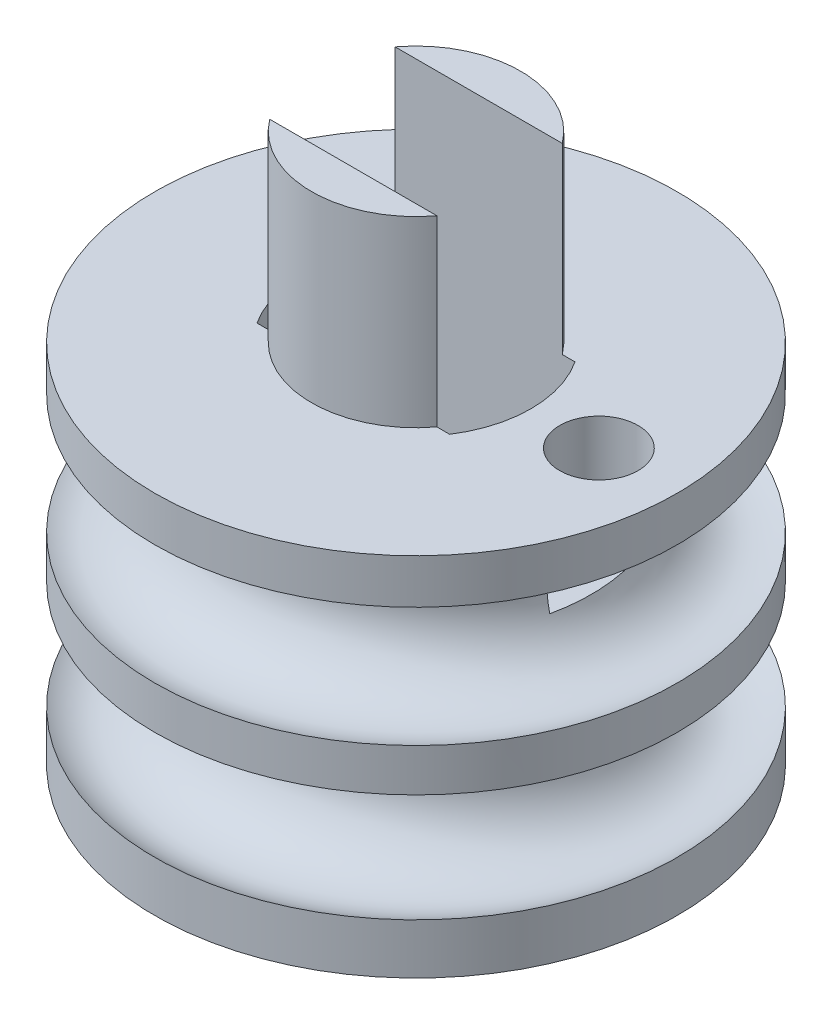
from build123d import *

# Parameters (mm, degrees)
SKETCH_1_R          = 2.75
EXTRUDE_1_DEPTH     = 8
CUT_EXTRUDE_1_DEPTH = 7
EXTRUDE_2_DEPTH     = 3.5
EXTRUDE_START       = -8
SKETCH_5_R          = 5
SKETCH_5_R_2        = 2.75
EXTRUDE_3_DEPTH     = 8
SWEEP_1_PROFILE_R   = 1.25
SWEEP_2_PROFILE_R   = 1.25
SKETCH_43_R         = 0.75
CUT_EXTRUDE_2_DEPTH = 2.5
SKETCH_47_R         = 5
SKETCH_47_R_2       = 2.5
CUT_EXTRUDE_3_DEPTH = 1
SKETCH_48_R         = 0.75
CUT_EXTRUDE_4_DEPTH = 2.5


with BuildPart() as part:
    # 草图1 → 凸台-拉伸1 (new body)
    with BuildSketch(Plane(origin=(0, 0, 0), x_dir=(1, 0, 0), z_dir=(0, 1, 0))):
        with Locations(Location((0, 0, 0), (0, 0, 270))):
            Circle(SKETCH_1_R)
    extrude(amount=EXTRUDE_1_DEPTH)

    # 草图2 → 切除-拉伸1 (cut)
    with BuildSketch(Plane(origin=(0, 8, 0), x_dir=(1, 0, 0), z_dir=(0, 1, 0))):
        with BuildLine():
            Line((1.843908891, 1.2), (-1.843908891, 1.2))
            ThreePointArc((-1.843908891, 1.2), (-2.2, 0), (-1.843908891, -1.2))
            Line((-1.843908891, -1.2), (1.843908891, -1.2))
            ThreePointArc((1.843908891, -1.2), (2.109099282, -0.625859584), (2.2, 0))
            ThreePointArc((2.2, 0), (2.109099282, 0.625859584), (1.843908891, 1.2))
        make_face()
    extrude(amount=-CUT_EXTRUDE_1_DEPTH, mode=Mode.SUBTRACT)

    # 草图4 → 凸台-拉伸2 (add)
    with BuildSketch(Plane(origin=(0, 8, 0), x_dir=(1, 0, 0), z_dir=(0, 1, 0))):
        with BuildLine():
            ThreePointArc((1.6, 1.2), (0, 2), (-1.6, 1.2))
            Line((-1.6, 1.2), (1.6, 1.2))
        make_face()
        with BuildLine():
            ThreePointArc((-1.6, -1.2), (0, -2), (1.6, -1.2))
            Line((1.6, -1.2), (-1.6, -1.2))
        make_face()
    extrude(amount=EXTRUDE_2_DEPTH)

    # 草图5 → 凸台-拉伸3 (add)
    with BuildSketch(Plane(origin=(0, 8, 0), x_dir=(1, 0, 0), z_dir=(0, 1, 0)).offset(EXTRUDE_START)):
        with Locations(Location((0, 0, 0), (0, 0, 270))):
            Circle(SKETCH_5_R)
        Circle(SKETCH_5_R_2, mode=Mode.SUBTRACT)
    extrude(amount=EXTRUDE_3_DEPTH)

    # 切除-扫描1: sweep along a path in 草图16
    with BuildLine(Plane(origin=(0, 3, 0), x_dir=(-1, 0, 0), z_dir=(0, -1, 0))) as sweep_1_path:
        CenterArc((0, 0), 4.3, 0, 360)
    # 切除-扫描1 profile (on start of the path) → 切除-扫描1 (sweep, cut)
    with BuildSketch(Plane(origin=(-4.3, 3, 0), x_dir=(-1, 0, 0), z_dir=(0, 0, -1))):
        Circle(SWEEP_1_PROFILE_R)
    sweep(path=sweep_1_path.line, mode=Mode.SUBTRACT)

    # 切除-扫描2: sweep along a path in 草图30
    with BuildLine(Plane(origin=(0, 6, 0), x_dir=(1, 0, 0), z_dir=(0, 1, 0))) as sweep_2_path:
        CenterArc((0, 0), 4.5, 0, 360)
    # 切除-扫描2 profile (on start of the path) → 切除-扫描2 (sweep, cut)
    with BuildSketch(Plane(origin=(4.5, 6, 0), x_dir=(-1, 0, 0), z_dir=(0, 0, -1))):
        Circle(SWEEP_2_PROFILE_R)
    sweep(path=sweep_2_path.line, mode=Mode.SUBTRACT)

    # 草图43 → 切除-拉伸2 (cut)
    with BuildSketch(Plane(origin=(0, 8, 0), x_dir=(1, 0, 0), z_dir=(0, 1, 0))):
        with Locations(Location((3.5, 0, 0), (0, 0, 270))):
            Circle(SKETCH_43_R)
    extrude(amount=-CUT_EXTRUDE_2_DEPTH, mode=Mode.SUBTRACT)

    # 草图47 → 切除-拉伸3 (cut)
    with BuildSketch(Plane.XZ):
        with Locations(Location((0, 0, 0), (0, 0, 270))):
            Circle(SKETCH_47_R)
        with Locations(Location((0, 0, 0), (0, 0, 270))):
            Circle(SKETCH_47_R_2, mode=Mode.SUBTRACT)
    extrude(amount=-CUT_EXTRUDE_3_DEPTH, mode=Mode.SUBTRACT)

    # 草图48 → 切除-拉伸4 (cut)
    with BuildSketch(Plane.XZ.offset(-1)):
        with Locations(Location((-3.5, 0, 0), (0, 0, 270))):
            Circle(SKETCH_48_R)
    extrude(amount=-CUT_EXTRUDE_4_DEPTH, mode=Mode.SUBTRACT)


solid = part.part
